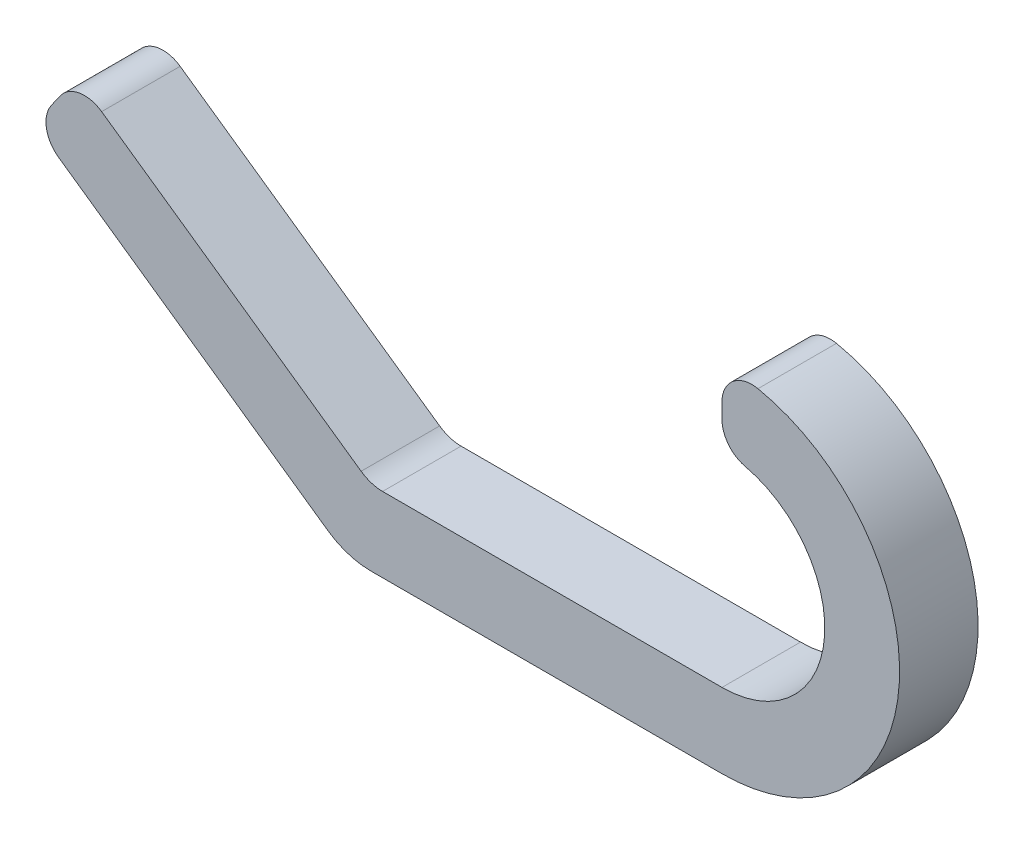
from build123d import *

# Parameters (mm, degrees)
BOSS_EXTRU_1_DEPTH = 21
CONG_1_R           = 8
CONG_2_R           = 20
CONG_3_R           = 10


with BuildPart() as part:
    # Esquisse2 → Boss.-Extru.1 (new body)
    with BuildSketch(Plane.XY):
        with BuildLine():
            Line((0, 0), (93.951859629, 0))
            ThreePointArc((93.951859629, 0), (121.451859629, 27.5), (93.951859629, 55))
            Line((93.951859629, 55), (93.951859629, 75))
            ThreePointArc((93.951859629, 75), (141.451859629, 27.5), (93.951859629, -20))
            Line((93.951859629, -20), (-6.305975778, -20))
            Line((-6.305975778, -20), (-90.019669098, 38.616959114))
            Line((-90.019669098, 38.616959114), (-78.548140371, 55))
            Line((-78.548140371, 55), (0, 0))
        make_face()
    extrude(amount=BOSS_EXTRU_1_DEPTH)

    # Congé1
    cong_1_edges = [part.edges().sort_by_distance(p)[0] for p in [
        (93.951859629, 55, 10.5),
        (93.951859629, 75, 10.5),
        (-90.019669098, 38.616959114, 10.5),
        (-78.548140371, 55, 10.5),
    ]]
    fillet(cong_1_edges, radius=CONG_1_R)

    # Congé2
    cong_2_edges = [part.edges().sort_by_distance(p)[0] for p in [
        (-6.305975778, -20, 10.5),
    ]]
    fillet(cong_2_edges, radius=CONG_2_R)

    # Congé3
    cong_3_edges = [part.edges().sort_by_distance(p)[0] for p in [
        (0, 0, 10.5),
    ]]
    fillet(cong_3_edges, radius=CONG_3_R)


solid = part.part
